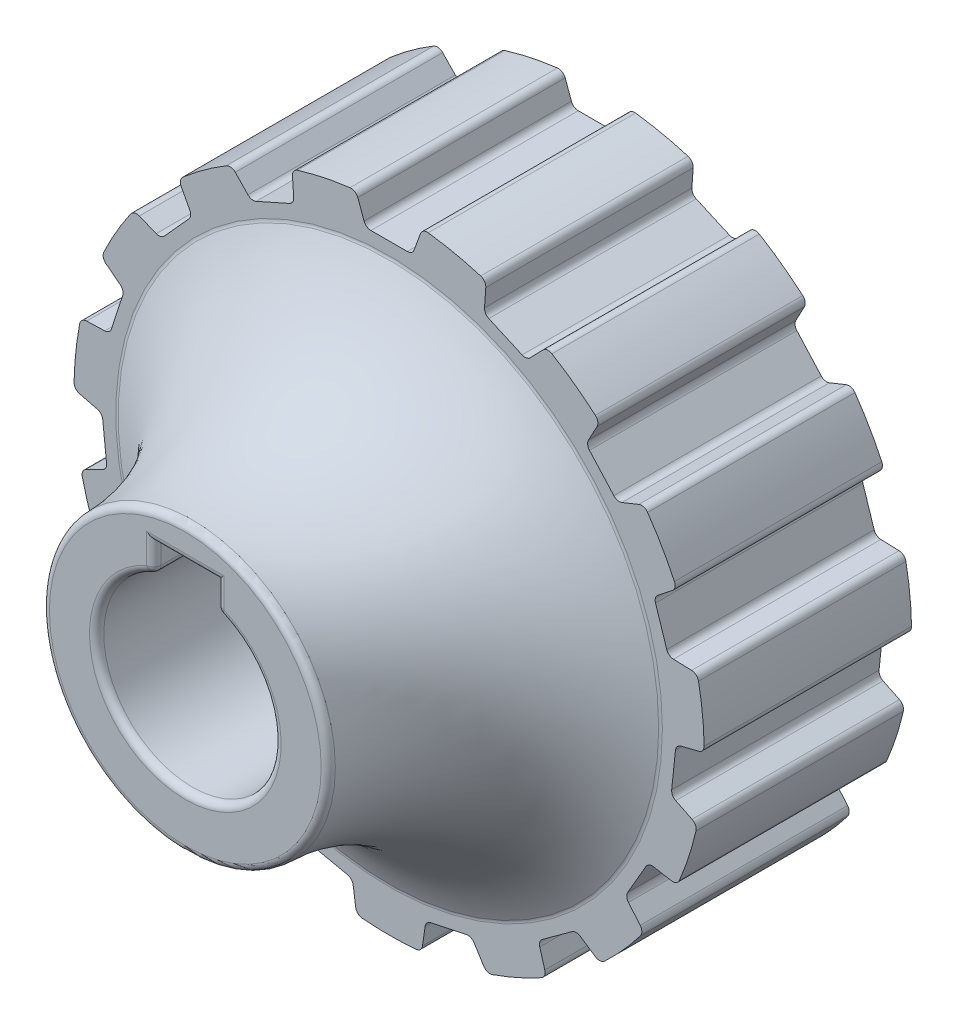
from build123d import *

# Parameters (mm, degrees)
BOSS_EXTRUDE1_DEPTH      = 7.25
BOSS_EXTRUDE1_DEPTH_BACK = 7.25
SKETCH7_R                = 22.031647778
CUT_EXTRUDE2_DEPTH       = 38.855475266
CUT_EXTRUDE2_DEPTH_BACK  = 38.855475266
FILLET2_R                = 0.51
CUT_EXTRUDE3_DEPTH       = 38.853094297
CUT_EXTRUDE3_DEPTH_BACK  = 38.853094297
SKETCH15_R               = 8.008120878
SKETCH15_R_2             = 2.25
BOSS_EXTRUDE2_DEPTH      = 5.5
SKETCH16_R               = 5
CUT_EXTRUDE4_DEPTH       = 3
FILLET3_R                = 0.5


with BuildPart() as part:
    # Sketch7 → Boss-Extrude1 (new, two sides: drawn at the far end of the back side and taken through both)
    with BuildSketch(Plane.XY.offset(-BOSS_EXTRUDE1_DEPTH_BACK)):
        Circle(SKETCH7_R)
    extrude(amount=BOSS_EXTRUDE1_DEPTH + BOSS_EXTRUDE1_DEPTH_BACK)

    # Sketch14 → Revolve1 (revolve)
    with BuildSketch(Plane(origin=(0, 0, 0), x_dir=(0, 0, -1), z_dir=(1, 0, 0))):
        with BuildLine():
            Line((-21.5, 0), (0, 0))
            Line((0, 0), (0, 19))
            Line((0, 19), (-7.25, 19))
            ThreePointArc((-7.25, 19), (-13.040017522, 12.386277742), (-21.5, 10))
            Line((-21.5, 10), (-21.5, 0))
        make_face()
    revolve(axis=Axis((0, 0, -36.129595921), (0, 0, 1)))

    # Sketch8 → Cut-Extrude2 (cut, two sides: drawn at the far end of the back side and taken through both)
    with BuildSketch(Plane.XY.offset(-CUT_EXTRUDE2_DEPTH_BACK)):
        Polygon((-1.629816853, 19.998625671), (-2.369776385, 22.031647778), (2.369776385, 22.031647778), (1.629816853, 19.998625671), align=None)
        Polygon((6.645262089, 18.932559877), (6.796180007, 21.090786644), (11.125976911, 19.16303686), (9.623085654, 17.606747406), align=None)
        Polygon((13.771314846, 14.592882482), (14.787015134, 16.503136895), (17.958394952, 12.980962779), (15.952435523, 12.170502561), align=None)
        Polygon((18.516182157, 7.729963135), (20.221041008, 9.061944851), (21.68564336, 4.554362304), (19.523464367, 4.629867259), align=None)
        Polygon((20.059433359, -0.469537064), (22.15866519, 0.053860216), (21.663247022, -4.659728787), (19.718708857, -3.711314154), align=None)
        Polygon((18.134226299, -8.587850038), (20.264854855, -8.963537338), (17.89507847, -13.06811044), (16.504409446, -11.410775634), align=None)
        Polygon((13.073446767, -15.221245722), (14.867067016, -16.431057856), (11.032688279, -19.216897077), (10.436347704, -17.137210342), align=None)
        Polygon((5.752149521, -19.222749741), (6.898628226, -21.057499199), (2.262646056, -22.042907629), (2.563746633, -19.900465696), align=None)
        Polygon((-2.563746633, -19.900465696), (-2.262646056, -22.042907629), (-6.898628226, -21.057499199), (-5.752149521, -19.222749741), align=None)
        Polygon((-10.436347704, -17.137210342), (-11.032688279, -19.216897077), (-14.867067016, -16.431057856), (-13.073446767, -15.221245722), align=None)
        Polygon((-16.504409446, -11.410775634), (-17.89507847, -13.06811044), (-20.264854855, -8.963537338), (-18.134226299, -8.587850038), align=None)
        Polygon((-19.718708857, -3.711314154), (-21.663247022, -4.659728787), (-22.15866519, 0.053860216), (-20.059433359, -0.469537064), align=None)
        Polygon((-19.523464367, 4.629867259), (-21.68564336, 4.554362304), (-20.221041008, 9.061944851), (-18.516182157, 7.729963135), align=None)
        Polygon((-15.952435523, 12.170502561), (-17.958394952, 12.980962779), (-14.787015134, 16.503136895), (-13.771314846, 14.592882482), align=None)
        Polygon((-9.623085654, 17.606747406), (-11.125976911, 19.16303686), (-6.796180007, 21.090786644), (-6.645262089, 18.932559877), align=None)
    extrude(amount=CUT_EXTRUDE2_DEPTH + CUT_EXTRUDE2_DEPTH_BACK, mode=Mode.SUBTRACT)

    # Fillet2
    fillet2_edges = [part.edges().sort_by_distance(p)[0] for p in [
        (-6.787047671, 20.960188161, 0),
        (-11.035034049, 19.06886277, 0),
        (-14.725553141, 16.387543699, 0),
        (-17.837010461, 12.931920261, 0),
        (-20.117876696, 8.981344056, 0),
        (-21.55480572, 4.558931255, 0),
        (-22.031636605, 0.022188433, 0),
        (-21.545579251, -4.60233838, 0),
        (-20.135926394, -8.940803772, 0),
        (-17.810926394, -12.9678219, 0),
        (-14.75853158, -16.35784978, 0),
        (-10.996602556, -19.091051203, 0),
        (-6.829252579, -20.946474955, 0),
        (-2.280866235, -21.913264317, 0),
        (2.280866235, -21.913264317, 0),
        (6.829252579, -20.946474955, 0),
        (10.996602556, -19.091051203, 0),
        (14.75853158, -16.35784978, 0),
        (17.810926394, -12.9678219, 0),
        (20.135926394, -8.940803772, 0),
        (21.545579251, -4.60233838, 0),
        (22.031636605, 0.022188433, 0),
        (21.55480572, 4.558931255, 0),
        (20.117876696, 8.981344056, 0),
        (17.837010461, 12.931920261, 0),
        (14.725553141, 16.387543699, 0),
        (11.035034049, 19.06886277, 0),
        (6.787047671, 20.960188161, 0),
        (2.325, 21.908625671, 0),
        (-6.645262089, 18.932559877, 0),
        (-9.623085654, 17.606747406, 0),
        (-13.771314846, 14.592882482, 0),
        (-15.952435523, 12.170502561, 0),
        (-18.516182157, 7.729963135, 0),
        (-19.523464367, 4.629867259, 0),
        (-20.059433359, -0.469537064, 0),
        (-19.718708857, -3.711314154, 0),
        (-18.134226299, -8.587850038, 0),
        (-16.504409446, -11.410775634, 0),
        (-13.073446767, -15.221245722, 0),
        (-10.436347704, -17.137210342, 0),
        (-5.752149521, -19.222749741, 0),
        (-2.563746633, -19.900465696, 0),
        (2.563746633, -19.900465696, 0),
        (5.752149521, -19.222749741, 0),
        (10.436347704, -17.137210342, 0),
        (13.073446767, -15.221245722, 0),
        (16.504409446, -11.410775634, 0),
        (18.134226299, -8.587850038, 0),
        (19.718708857, -3.711314154, 0),
        (20.059433359, -0.469537064, 0),
        (19.523464367, 4.629867259, 0),
        (18.516182157, 7.729963135, 0),
        (15.952435523, 12.170502561, 0),
        (13.771314846, 14.592882482, 0),
        (9.623085654, 17.606747406, 0),
        (6.645262089, 18.932559877, 0),
        (1.629816853, 19.998625671, 0),
        (-1.629816853, 19.998625671, 0),
        (-2.325, 21.908625671, 0),
    ]]
    fillet(fillet2_edges, radius=FILLET2_R)

    # Sketch10 → Cut-Extrude3 (cut, two sides: drawn at the far end of the back side and taken through both)
    with BuildSketch(Plane.XY.offset(-CUT_EXTRUDE3_DEPTH_BACK)):
        with BuildLine():
            Line((2.2, 7.7), (-2.2, 7.7))
            Line((-2.2, 7.7), (-2.2, 5.796550698))
            ThreePointArc((-2.2, 5.796550698), (0, -6.2), (2.2, 5.796550698))
            Line((2.2, 5.796550698), (2.2, 7.7))
        make_face()
    extrude(amount=CUT_EXTRUDE3_DEPTH + CUT_EXTRUDE3_DEPTH_BACK, mode=Mode.SUBTRACT)

    # Sketch15 → Boss-Extrude2 (add)
    with BuildSketch(Plane(origin=(0, 0, -7.25), x_dir=(-1, 0, 0), z_dir=(0, 0, -1))):
        Circle(SKETCH15_R)
        Circle(SKETCH15_R_2, mode=Mode.SUBTRACT)
    extrude(amount=-BOSS_EXTRUDE2_DEPTH)

    # Sketch16 → Cut-Extrude4 (cut)
    with BuildSketch(Plane(origin=(0, 0, -7.25), x_dir=(-1, 0, 0), z_dir=(0, 0, -1))):
        Circle(SKETCH16_R)
    extrude(amount=-CUT_EXTRUDE4_DEPTH, mode=Mode.SUBTRACT)

    # Fillet3
    fillet3_edges = [part.edges().sort_by_distance(p)[0] for p in [
        (2.2, 5.796550698, 9.875),
        (-2.2, 5.796550698, 9.875),
        (2.2, 6.748275349, 21.5),
        (-2.2, 6.748275349, 21.5),
        (0, 7.7, 21.5),
        (0, -19, 7.25),
        (0, -10, 21.5),
        (0, -6.2, 21.5),
        (5, 0, -7.25),
        (5, 0, -4.25),
        (2.25, 0, -4.25),
    ]]
    fillet(fillet3_edges, radius=FILLET3_R)


solid = part.part
